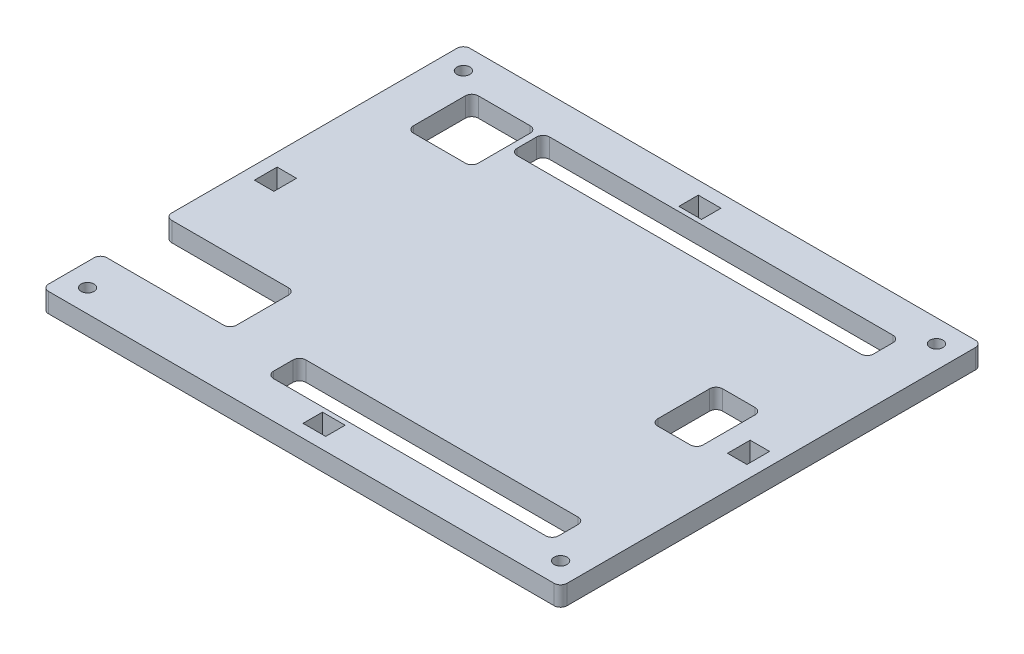
from build123d import *

# Parameters (mm, degrees)
CROQUIS1_R              = 1
CROQUIS1_W              = 3
CROQUIS1_H              = 3.5
CROQUIS1_W_2            = 3.5
CROQUIS1_H_2            = 3
SALIENTE_EXTRUIR1_DEPTH = 3


with BuildPart() as part:
    # Croquis1 → Saliente-Extruir1 (new body)
    with BuildSketch(Plane(origin=(0, 0, 0), x_dir=(1, 0, 0), z_dir=(0, 1, 0))):
        with BuildLine():
            Line((-39, -32.5), (39, -32.5))
            ThreePointArc((39, -32.5), (39.707106781, -32.207106781), (40, -31.5))
            Line((40, -31.5), (40, 31.5))
            ThreePointArc((40, 31.5), (39.707106781, 32.207106781), (39, 32.5))
            Line((39, 32.5), (-39, 32.5))
            ThreePointArc((-39, 32.5), (-39.707106781, 32.207106781), (-40, 31.5))
            Line((-40, 31.5), (-40, -12.5))
            ThreePointArc((-40, -12.5), (-39.707106781, -13.207106781), (-39, -13.5))
            Line((-39, -13.5), (-21, -13.5))
            ThreePointArc((-21, -13.5), (-20.292893219, -13.792893219), (-20, -14.5))
            Line((-20, -14.5), (-20, -22.5))
            ThreePointArc((-20, -22.5), (-20.292893219, -23.207106781), (-21, -23.5))
            Line((-21, -23.5), (-39, -23.5))
            ThreePointArc((-39, -23.5), (-39.707106781, -23.792893219), (-40, -24.5))
            Line((-40, -24.5), (-40, -31.5))
            ThreePointArc((-40, -31.5), (-39.707106781, -32.207106781), (-39, -32.5))
        make_face()
        with Locations(Location((-36.5, 29, 0), (0, 0, 270))):
            Circle(CROQUIS1_R, mode=Mode.SUBTRACT)
        with Locations(Location((-36.5, -29, 0), (0, 0, 270))):
            Circle(CROQUIS1_R, mode=Mode.SUBTRACT)
        with Locations(Location((36.5, 29, 0), (0, 0, 270))):
            Circle(CROQUIS1_R, mode=Mode.SUBTRACT)
        with Locations(Location((36.5, -29, 0), (0, 0, 270))):
            Circle(CROQUIS1_R, mode=Mode.SUBTRACT)
        with Locations((-36.5, 0)):
            Rectangle(CROQUIS1_W, CROQUIS1_H, mode=Mode.SUBTRACT)
        with Locations((36.5, 0)):
            Rectangle(CROQUIS1_W, CROQUIS1_H, mode=Mode.SUBTRACT)
        with Locations((0, -29)):
            Rectangle(CROQUIS1_W_2, CROQUIS1_H_2, mode=Mode.SUBTRACT)
        with Locations((0, 29)):
            Rectangle(CROQUIS1_W_2, CROQUIS1_H_2, mode=Mode.SUBTRACT)
        with BuildLine():
            Line((-10, -26.8), (32, -26.8))
            ThreePointArc((32, -26.8), (32.707106781, -26.507106781), (33, -25.8))
            Line((33, -25.8), (33, -22.8))
            ThreePointArc((33, -22.8), (32.707106781, -22.092893219), (32, -21.8))
            Line((32, -21.8), (-10, -21.8))
            ThreePointArc((-10, -21.8), (-10.707106781, -22.092893219), (-11, -22.8))
            Line((-11, -22.8), (-11, -25.8))
            ThreePointArc((-11, -25.8), (-10.707106781, -26.507106781), (-10, -26.8))
        make_face(mode=Mode.SUBTRACT)
        with BuildLine():
            Line((26, 6.5), (31, 6.5))
            ThreePointArc((31, 6.5), (31.707106781, 6.207106781), (32, 5.5))
            Line((32, 5.5), (32, -2.5))
            ThreePointArc((32, -2.5), (31.707106781, -3.207106781), (31, -3.5))
            Line((31, -3.5), (26, -3.5))
            ThreePointArc((26, -3.5), (25.292893219, -3.207106781), (25, -2.5))
            Line((25, -2.5), (25, 5.5))
            ThreePointArc((25, 5.5), (25.292893219, 6.207106781), (26, 6.5))
        make_face(mode=Mode.SUBTRACT)
        with BuildLine():
            Line((-21, 26.8), (32, 26.8))
            ThreePointArc((32, 26.8), (32.707106781, 26.507106781), (33, 25.8))
            Line((33, 25.8), (33, 22.8))
            ThreePointArc((33, 22.8), (32.707106781, 22.092893219), (32, 21.8))
            Line((32, 21.8), (-21, 21.8))
            ThreePointArc((-21, 21.8), (-21.707106781, 22.092893219), (-22, 22.8))
            Line((-22, 22.8), (-22, 25.8))
            ThreePointArc((-22, 25.8), (-21.707106781, 26.507106781), (-21, 26.8))
        make_face(mode=Mode.SUBTRACT)
        with BuildLine():
            Line((-32, 26.8), (-24, 26.8))
            ThreePointArc((-24, 26.8), (-23.292893219, 26.507106781), (-23, 25.8))
            Line((-23, 25.8), (-23, 17.8))
            ThreePointArc((-23, 17.8), (-23.292893219, 17.092893219), (-24, 16.8))
            Line((-24, 16.8), (-32, 16.8))
            ThreePointArc((-32, 16.8), (-32.707106781, 17.092893219), (-33, 17.8))
            Line((-33, 17.8), (-33, 25.8))
            ThreePointArc((-33, 25.8), (-32.707106781, 26.507106781), (-32, 26.8))
        make_face(mode=Mode.SUBTRACT)
    extrude(amount=SALIENTE_EXTRUIR1_DEPTH)


solid = part.part
